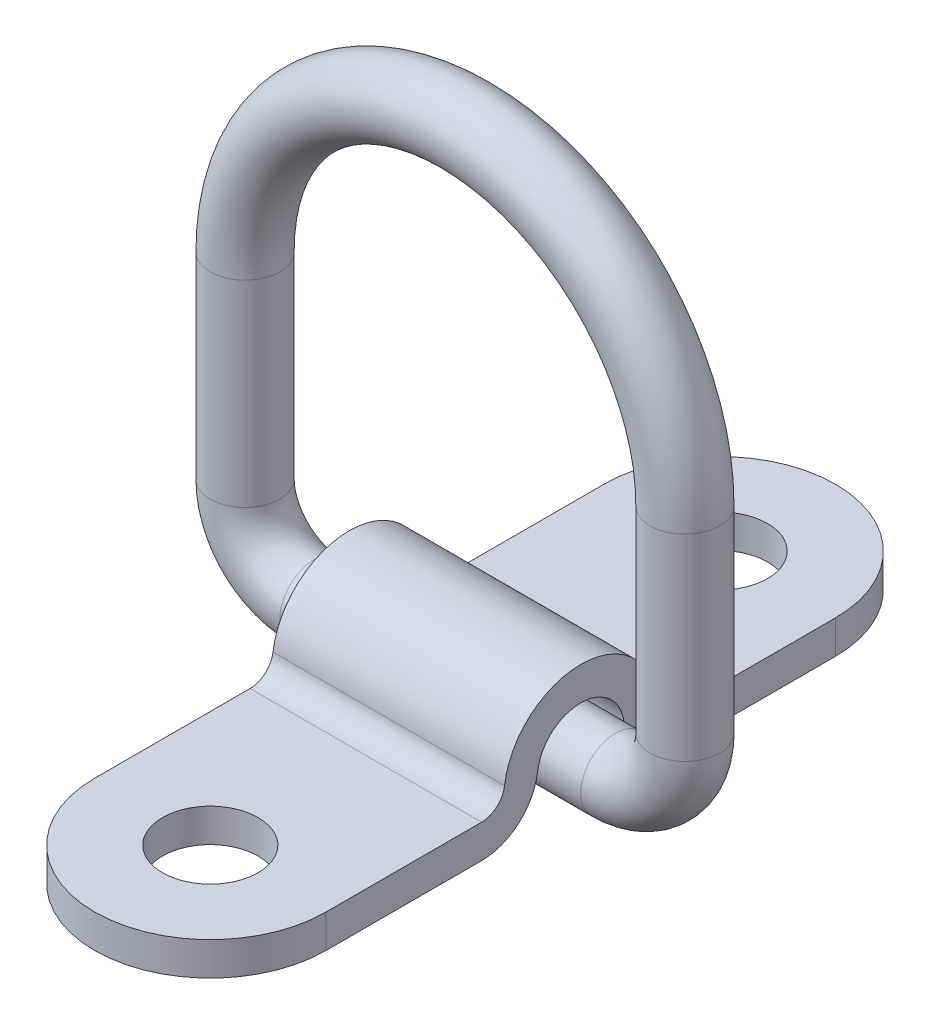
from build123d import *

# Parameters (mm, degrees)
SKETCH2_R           = 2.38125
BOSS_EXTRUDE1_DEPTH = 7.9375
SKETCH4_R           = 3.2766
CUT_EXTRUDE1_DEPTH  = 50.477676563


with BuildPart() as part:
    # Sweep1: sweep along a path in Sketch1
    with BuildLine(Plane.XY) as sweep1_path:
        Line((-15.08125, 18.25625), (-15.08125, 4.7625))
        ThreePointArc((-15.08125, 4.7625), (-13.686346045, 1.394903955), (-10.31875, 0))
        Line((-10.31875, 0), (10.31875, 0))
        ThreePointArc((10.31875, 0), (13.686346045, 1.394903955), (15.08125, 4.7625))
        Line((15.08125, 4.7625), (15.08125, 18.25625))
        ThreePointArc((15.08125, 18.25625), (0, 33.3375), (-15.08125, 18.25625))
    # Sketch2 → Sweep1 (sweep)
    with BuildSketch(Plane(origin=(0, 0, 0), x_dir=(0, 0, -1), z_dir=(1, 0, 0))):
        Circle(SKETCH2_R)
    sweep(path=sweep1_path.line)


with BuildPart() as body_2:
    # Sketch3 → Boss-Extrude1 (new, symmetric)
    with BuildSketch(Plane(origin=(0, 0, 0), x_dir=(0, 0, -1), z_dir=(1, 0, 0))):
        with BuildLine():
            Line((-25.4, -2.9845), (-6.800135513, -2.9845))
            ThreePointArc((-6.800135513, -2.9845), (-4.244843065, -2.022096486), (-2.959318233, 0.38687963))
            ThreePointArc((-2.959318233, 0.38687963), (0, 2.9845), (2.959318233, 0.38687963))
            ThreePointArc((2.959318233, 0.38687963), (4.244843065, -2.022096486), (6.800135513, -2.9845))
            Line((6.800135513, -2.9845), (25.4, -2.9845))
            Line((25.4, -2.9845), (25.4, -0.6985))
            Line((25.4, -0.6985), (6.800135513, -0.6985))
            ThreePointArc((6.800135513, -0.6985), (5.75288451, -0.30407233), (5.22603007, 0.683212963))
            ThreePointArc((5.22603007, 0.683212963), (0, 5.2705), (-5.22603007, 0.683212963))
            ThreePointArc((-5.22603007, 0.683212963), (-5.75288451, -0.30407233), (-6.800135513, -0.6985))
            Line((-6.800135513, -0.6985), (-25.4, -0.6985))
            Line((-25.4, -0.6985), (-25.4, -2.9845))
        make_face()
    extrude(amount=BOSS_EXTRUDE1_DEPTH, both=True)

    # Sketch4 → Cut-Extrude1 (cut, through all)
    with BuildSketch(Plane.XZ.offset(2.9845)):
        with Locations(Location((0, 17.4625, 0), (0, 0, 270))):
            Circle(SKETCH4_R)
        with Locations(Location((0, -17.4625, 0), (0, 0, 270))):
            Circle(SKETCH4_R)
        with BuildLine():
            Line((-7.9375, 17.4625), (-7.9375, 25.4))
            Line((-7.9375, 25.4), (-7.9375, 26.67))
            Line((-7.9375, 26.67), (7.9375, 26.67))
            Line((7.9375, 26.67), (7.9375, 25.4))
            Line((7.9375, 25.4), (7.9375, 17.4625))
            ThreePointArc((7.9375, 17.4625), (0, 25.4), (-7.9375, 17.4625))
        make_face()
        with BuildLine():
            Line((7.9375, -25.4), (7.9375, -17.4625))
            ThreePointArc((7.9375, -17.4625), (0, -25.4), (-7.9375, -17.4625))
            Line((-7.9375, -17.4625), (-7.9375, -25.4))
            Line((-7.9375, -25.4), (-7.9375, -26.67))
            Line((-7.9375, -26.67), (7.9375, -26.67))
            Line((7.9375, -26.67), (7.9375, -25.4))
        make_face()
    extrude(amount=-CUT_EXTRUDE1_DEPTH, mode=Mode.SUBTRACT)


solid = Compound([part.part, body_2.part])
